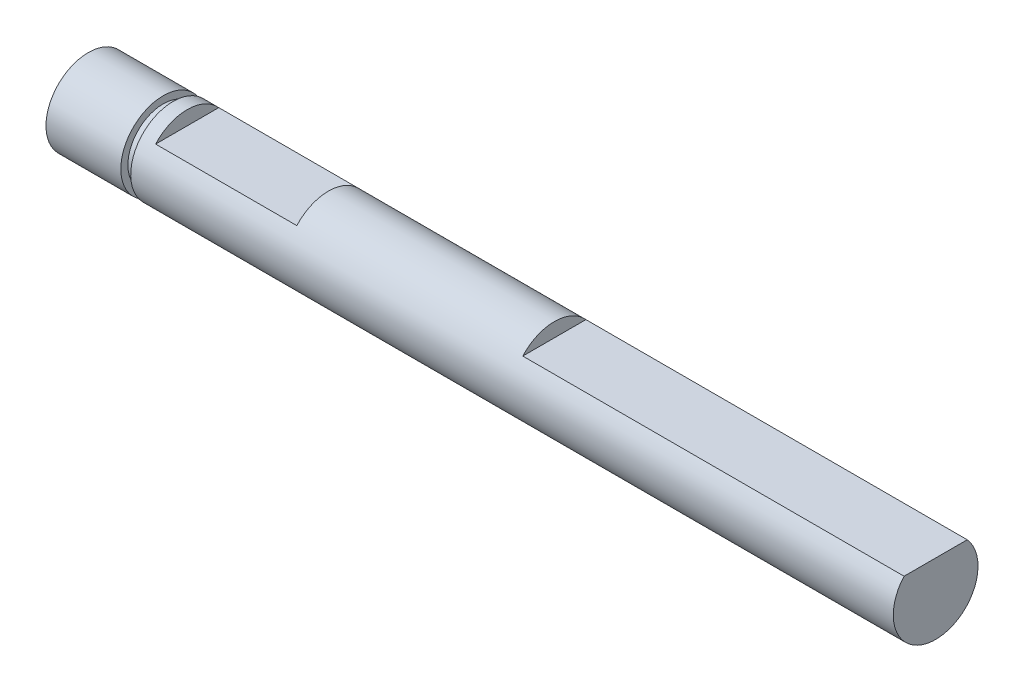
from build123d import *

# Parameters (mm, degrees)
ESQUISSE2_W             = 10
ESQUISSE2_H             = 6
ESQUISSE2_W_2           = 27
ENL_V_MAT_EXTRU_1_DEPTH = 1


with BuildPart() as part:
    # Esquisse1 → Révolution1 (revolve)
    with BuildSketch(Plane.XY):
        Polygon((0, 0), (0, 3), (5.3, 3), (5.3, 2.5), (6, 2.5), (6, 3), (60, 3), (60, 0), align=None)
    revolve(axis=Axis((60, 0, 0), (-1, 0, 0)))

    # Esquisse2 → Enlèv. mat.-Extru.1 (cut)
    with BuildSketch(Plane(origin=(0, 3, 0), x_dir=(1, 0, 0), z_dir=(0, 1, 0))):
        with Locations((12, 0)):
            Rectangle(ESQUISSE2_W, ESQUISSE2_H)
        with Locations((46.5, 0)):
            Rectangle(ESQUISSE2_W_2, ESQUISSE2_H)
    extrude(amount=-ENL_V_MAT_EXTRU_1_DEPTH, mode=Mode.SUBTRACT)


solid = part.part
